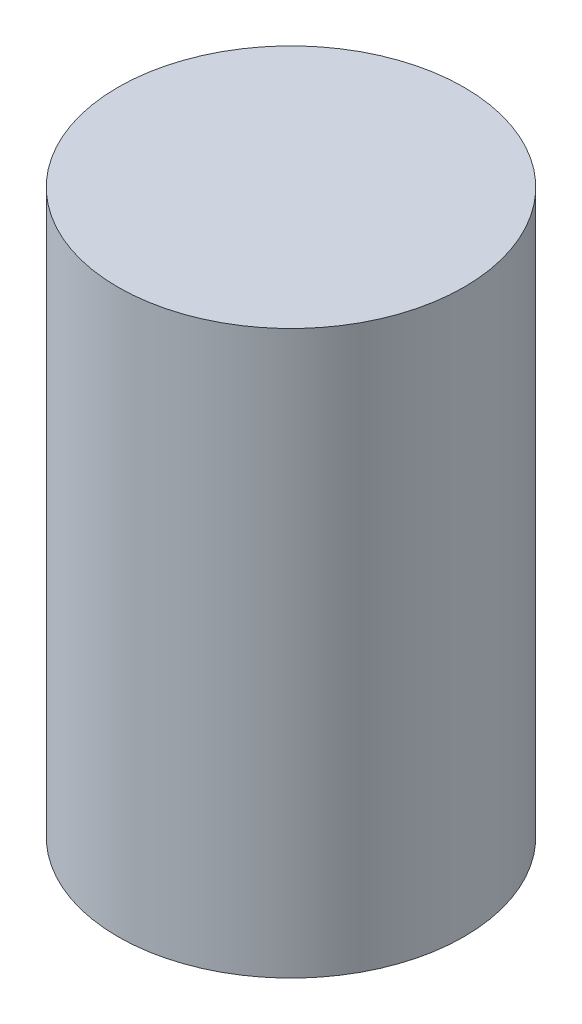
from build123d import *

# Parameters (mm, degrees)
CAN_START = 3
SKETCH1_R = 8
CAN_DEPTH = 26


with BuildPart() as part:
    # Sketch1 → Can (new body)
    with BuildSketch(Plane(origin=(0, 0, 0), x_dir=(1, 0, 0), z_dir=(0, 1, 0)).offset(CAN_START)):
        with Locations(Location((-44, 44, 0), (0, 0, 90))):
            Circle(SKETCH1_R)
    extrude(amount=CAN_DEPTH)


solid = part.part
